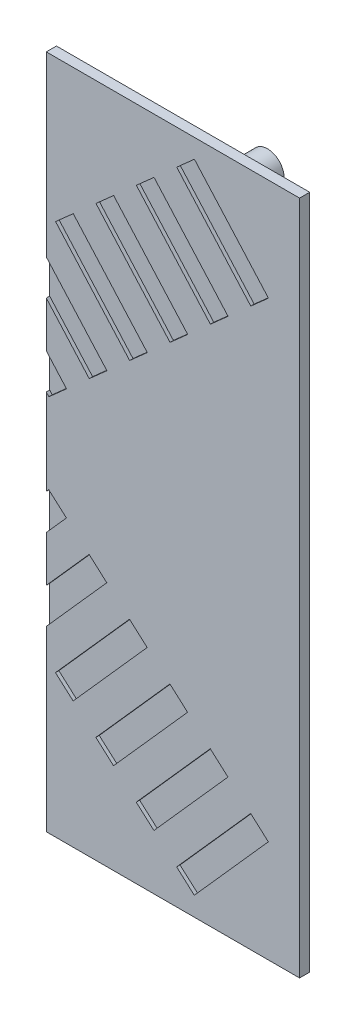
from build123d import *

# Parameters (mm, degrees)
SKETCH1_W           = 225
SKETCH1_H           = 200
BOSS_EXTRUDE1_DEPTH = 3
CUT_EXTRUDE1_DEPTH  = 1
SKETCH4_R           = 4.9
BOSS_EXTRUDE2_DEPTH = 10
SKETCH5_W           = 150
SKETCH5_H           = 200
CUT_EXTRUDE2_DEPTH  = 10


with BuildPart() as part:
    # Sketch1 → Boss-Extrude1 (new body)
    with BuildSketch(Plane.XY):
        with Locations((112.5, 100)):
            Rectangle(SKETCH1_W, SKETCH1_H)
    extrude(amount=BOSS_EXTRUDE1_DEPTH)

    # Sketch2 → Cut-Extrude1 (cut)
    with BuildSketch(Plane.XY.offset(3)):
        Polygon((21.176597363, 159.100101172), (43.100604044, 183.764608689), (48.332469275, 179.114061817), (26.408462593, 154.4495543), align=None)
        Polygon((9.218048264, 169.729922593), (31.142054945, 194.39443011), (36.373920176, 189.743883238), (14.449913495, 165.079375722), align=None)
        Polygon((33.135146462, 148.470279751), (55.059153143, 173.134787267), (60.291018374, 168.484240396), (38.367011692, 143.819732879), align=None)
        Polygon((45.093695561, 137.840458329), (67.017702242, 162.504965846), (72.249567473, 157.854418974), (50.325560791, 133.189911458), align=None)
        Polygon((57.05224466, 127.210636908), (78.976251341, 151.875144425), (84.208116572, 147.224597553), (62.28410989, 122.560090036), align=None)
        Polygon((69.010793758, 116.580815487), (90.93480044, 141.245323003), (96.166665671, 136.594776132), (74.242658989, 111.930268615), align=None)
        Polygon((80.969342857, 105.950994066), (102.893349539, 130.615501582), (108.12521477, 125.96495471), (86.201208088, 101.300447194), align=None)
        Polygon((116.844990154, 74.061529802), (138.768996836, 98.726037318), (144.000862066, 94.075490447), (122.076855385, 69.41098293), align=None)
        Polygon((128.803539253, 63.431708381), (150.727545935, 88.096215897), (155.959411165, 83.445669025), (134.035404484, 58.781161509), align=None)
        Polygon((140.762088352, 52.801886959), (162.686095033, 77.466394476), (167.917960264, 72.815847604), (145.993953583, 48.151340087), align=None)
        Polygon((152.720637451, 42.172065538), (174.644644132, 66.836573055), (179.876509363, 62.186026183), (157.952502682, 37.521518666), align=None)
        Polygon((164.67918655, 31.542244117), (186.603193231, 56.206751633), (191.835058462, 51.556204761), (169.911051781, 26.891697245), align=None)
        Polygon((176.637735649, 20.912422695), (198.56174233, 45.576930212), (203.793607561, 40.92638334), (181.86960088, 16.261875824), align=None)
        Polygon((188.596284748, 10.282601274), (210.520291429, 34.947108791), (215.75215666, 30.296561919), (193.828149979, 5.632054402), align=None)
        Polygon((198.591537407, 154.4495543), (176.667530725, 179.114061817), (181.899395956, 183.764608689), (203.823402637, 159.100101172), align=None)
        Polygon((210.550086505, 165.079375721), (188.626079824, 189.743883238), (193.857945055, 194.39443011), (215.781951736, 169.729922593), align=None)
        Polygon((186.632988308, 143.819732879), (164.708981626, 168.484240395), (169.940846857, 173.134787267), (191.864853538, 148.470279751), align=None)
        Polygon((174.674439209, 133.189911458), (152.750432527, 157.854418974), (157.982297758, 162.504965846), (179.906304439, 137.840458329), align=None)
        Polygon((162.71589011, 122.560090036), (140.791883428, 147.224597553), (146.023748659, 151.875144425), (167.94775534, 127.210636908), align=None)
        Polygon((150.757341011, 111.930268615), (128.833334329, 136.594776132), (134.06519956, 141.245323003), (155.989206242, 116.580815487), align=None)
        Polygon((138.798791912, 101.300447194), (116.87478523, 125.96495471), (122.106650461, 130.615501582), (144.030657143, 105.950994066), align=None)
        Polygon((102.923144615, 69.41098293), (80.999137934, 94.075490447), (86.231003164, 98.726037318), (108.155009846, 74.061529802), align=None)
        Polygon((90.964595516, 58.781161509), (69.040588835, 83.445669025), (74.272454065, 88.096215897), (96.196460747, 63.431708381), align=None)
        Polygon((79.006046417, 48.151340087), (57.082039736, 72.815847604), (62.313904967, 77.466394476), (84.237911648, 52.801886959), align=None)
        Polygon((67.047497318, 37.521518666), (45.123490637, 62.186026183), (50.355355868, 66.836573055), (72.279362549, 42.172065538), align=None)
        Polygon((55.088948219, 26.891697245), (33.164941538, 51.556204761), (38.396806769, 56.206751633), (60.32081345, 31.542244117), align=None)
        Polygon((43.13039912, 16.261875824), (21.206392439, 40.92638334), (26.43825767, 45.576930212), (48.362264351, 20.912422695), align=None)
        Polygon((31.171850021, 5.632054402), (9.24784334, 30.296561919), (14.479708571, 34.947108791), (36.403715252, 10.282601274), align=None)
    extrude(amount=-CUT_EXTRUDE1_DEPTH, mode=Mode.SUBTRACT)

    # Sketch4 → Boss-Extrude2 (add)
    with BuildSketch(Plane(origin=(0, 0, 0), x_dir=(-1, 0, 0), z_dir=(0, 0, -1))):
        with Locations((-202.5, 190)):
            Circle(SKETCH4_R)
        with Locations((-162.5, 10)):
            Circle(SKETCH4_R)
    extrude(amount=BOSS_EXTRUDE2_DEPTH)

    # Sketch5 → Cut-Extrude2 (cut)
    with BuildSketch(Plane(origin=(0, 0, 0), x_dir=(-1, 0, 0), z_dir=(0, 0, -1))):
        with Locations((-75, 100)):
            Rectangle(SKETCH5_W, SKETCH5_H)
    extrude(amount=-CUT_EXTRUDE2_DEPTH, mode=Mode.SUBTRACT)


solid = part.part
